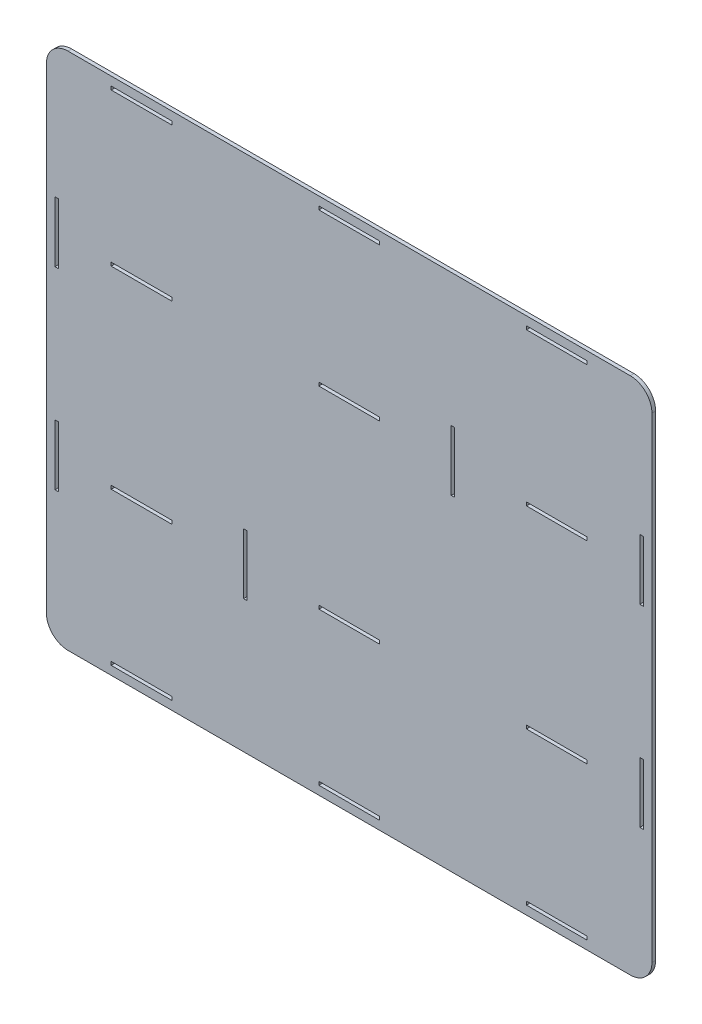
from build123d import *

# Parameters (mm, degrees)
SKETCH1_W           = 70
SKETCH1_H           = 4
SKETCH1_W_2         = 4
SKETCH1_H_2         = 70
BOSS_EXTRUDE1_DEPTH = 4.3


with BuildPart() as part:
    # Sketch1 → Boss-Extrude1 (new body)
    with BuildSketch(Plane.XY):
        with BuildLine():
            Line((-325, -300), (325, -300))
            ThreePointArc((325, -300), (342.67766953, -292.67766953), (350, -275))
            Line((350, -275), (350, 275))
            ThreePointArc((350, 275), (342.67766953, 292.67766953), (325, 300))
            Line((325, 300), (-325, 300))
            ThreePointArc((-325, 300), (-342.67766953, 292.67766953), (-350, 275))
            Line((-350, 275), (-350, -275))
            ThreePointArc((-350, -275), (-342.67766953, -292.67766953), (-325, -300))
        make_face()
        with Locations((-240, -288)):
            Rectangle(SKETCH1_W, SKETCH1_H, mode=Mode.SUBTRACT)
        with Locations((338, -111.6666)):
            Rectangle(SKETCH1_W_2, SKETCH1_H_2, mode=Mode.SUBTRACT)
        with Locations((338, 111.6667)):
            Rectangle(SKETCH1_W_2, SKETCH1_H_2, mode=Mode.SUBTRACT)
        with Locations((0, -288)):
            Rectangle(SKETCH1_W, SKETCH1_H, mode=Mode.SUBTRACT)
        with Locations((240, -288)):
            Rectangle(SKETCH1_W, SKETCH1_H, mode=Mode.SUBTRACT)
        with Locations((-338, 111.6667)):
            Rectangle(SKETCH1_W_2, SKETCH1_H_2, mode=Mode.SUBTRACT)
        with Locations((-338, -111.6666)):
            Rectangle(SKETCH1_W_2, SKETCH1_H_2, mode=Mode.SUBTRACT)
        with Locations((120, 111.6667)):
            Rectangle(SKETCH1_W_2, SKETCH1_H_2, mode=Mode.SUBTRACT)
        with Locations((-120, -111.6667)):
            Rectangle(SKETCH1_W_2, SKETCH1_H_2, mode=Mode.SUBTRACT)
        with Locations((0, 111.6667)):
            Rectangle(SKETCH1_W, SKETCH1_H, mode=Mode.SUBTRACT)
        with Locations((-240, 111.6667)):
            Rectangle(SKETCH1_W, SKETCH1_H, mode=Mode.SUBTRACT)
        with Locations((240, 111.6667)):
            Rectangle(SKETCH1_W, SKETCH1_H, mode=Mode.SUBTRACT)
        with Locations((-240, -111.6667)):
            Rectangle(SKETCH1_W, SKETCH1_H, mode=Mode.SUBTRACT)
        with Locations((0, -111.6667)):
            Rectangle(SKETCH1_W, SKETCH1_H, mode=Mode.SUBTRACT)
        with Locations((240, -111.6667)):
            Rectangle(SKETCH1_W, SKETCH1_H, mode=Mode.SUBTRACT)
        with Locations((-240, 288)):
            Rectangle(SKETCH1_W, SKETCH1_H, mode=Mode.SUBTRACT)
        with Locations((0, 288)):
            Rectangle(SKETCH1_W, SKETCH1_H, mode=Mode.SUBTRACT)
        with Locations((240, 288)):
            Rectangle(SKETCH1_W, SKETCH1_H, mode=Mode.SUBTRACT)
    extrude(amount=BOSS_EXTRUDE1_DEPTH)


solid = part.part
